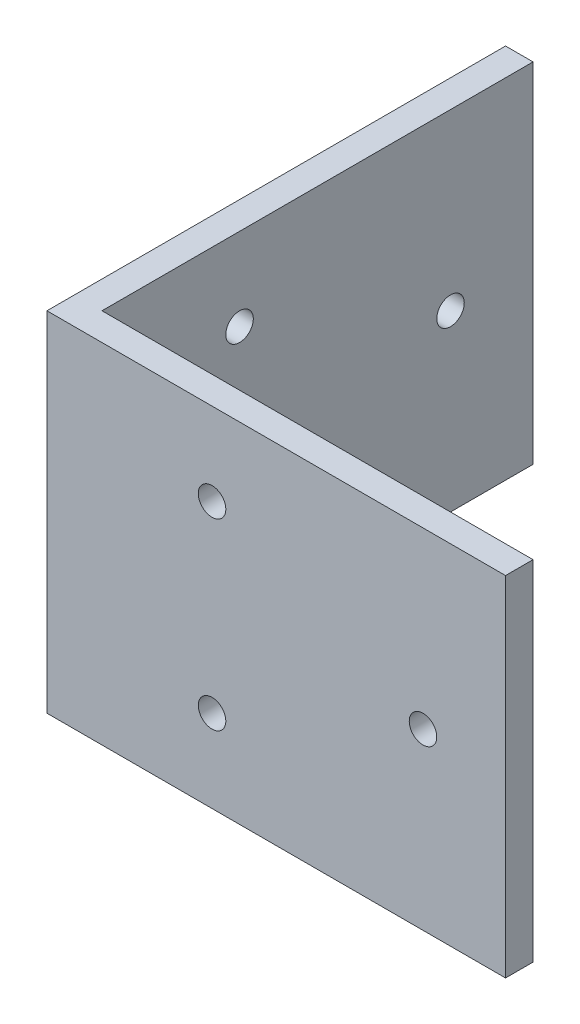
from build123d import *

# Parameters (mm, degrees)
EXTRUDE_2_DEPTH     = 38
SKETCH_4_R          = 1.5
CUT_EXTRUDE_1_DEPTH = 50
SKETCH_5_R          = 1.5
CUT_EXTRUDE_2_DEPTH = 50


with BuildPart() as part:
    # 草图3 → 凸台-拉伸2 (new body)
    with BuildSketch(Plane(origin=(0, 0, 0), x_dir=(1, 0, 0), z_dir=(0, 1, 0))):
        Polygon((0, 0), (0, -50), (50, -50), (50, -47), (3, -47), (3, 0), align=None)
    extrude(amount=EXTRUDE_2_DEPTH)

    # 草图4 → 切除-拉伸1 (cut)
    with BuildSketch(Plane(origin=(3, 0, 0), x_dir=(0, 0, -1), z_dir=(1, 0, 0))):
        with Locations((-32, 29)):
            Circle(SKETCH_4_R)
        with Locations((-32, 9)):
            Circle(SKETCH_4_R)
        with Locations((-9, 19)):
            Circle(SKETCH_4_R)
    extrude(amount=-CUT_EXTRUDE_1_DEPTH, mode=Mode.SUBTRACT)

    # 草图5 → 切除-拉伸2 (cut)
    with BuildSketch(Plane(origin=(0, 0, 47), x_dir=(-1, 0, 0), z_dir=(0, 0, -1))):
        with Locations((-18, 29)):
            Circle(SKETCH_5_R)
        with Locations((-18, 9)):
            Circle(SKETCH_5_R)
        with Locations((-41, 19)):
            Circle(SKETCH_5_R)
    extrude(amount=-CUT_EXTRUDE_2_DEPTH, mode=Mode.SUBTRACT)


solid = part.part
